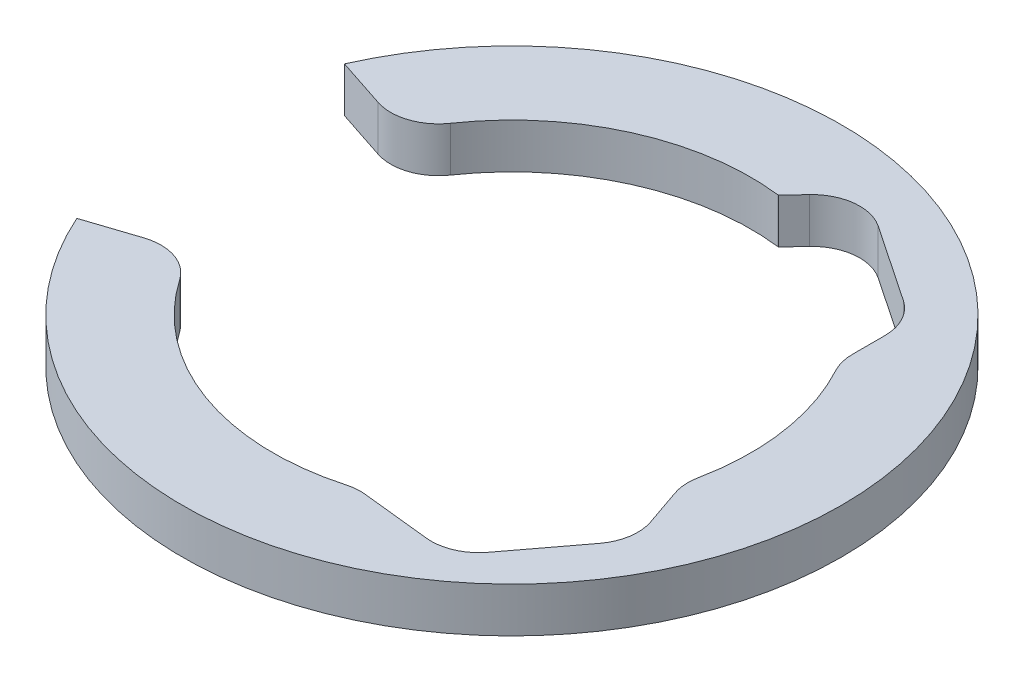
from build123d import *

# Parameters (mm, degrees)
BOSS_EXTRUDE1_DEPTH = 0.94


with BuildPart() as part:
    # Sketch1 → Boss-Extrude1 (new body)
    with BuildSketch(Plane(origin=(0, 0, 0), x_dir=(1, 0, 0), z_dir=(0, 1, 0))):
        with BuildLine():
            Line((-5.253863679, -2.454338371), (-6.305884625, -2.801038932))
            ThreePointArc((-6.305884625, -2.801038932), (6.9, 0), (-6.305884625, 2.801038932))
            Line((-6.305884625, 2.801038932), (-5.253863679, 2.454338371))
            ThreePointArc((-5.253863679, 2.454338371), (-4.621952363, 2.45630843), (-4.117388267, 2.83674353))
            ThreePointArc((-4.117388267, 2.83674353), (-2.052207562, 4.559434627), (0.606687952, 4.963056491))
            Line((0.606687952, 4.963056491), (0.616921004, 4.961794884))
            Line((0.616921004, 4.961794884), (0.933263365, 5.299935719))
            ThreePointArc((0.933263365, 5.299935719), (1.550759285, 5.61038152), (2.222116774, 5.446195866))
            Line((2.222116774, 5.446195866), (3.835339689, 4.359739617))
            ThreePointArc((3.835339689, 4.359739617), (4.159519117, 4.000089674), (4.276739309, 3.53030269))
            Line((4.276739309, 3.53030269), (4.276739309, 2.855875044))
            ThreePointArc((4.276739309, 2.855875044), (4.307343479, 2.610372041), (4.397282758, 2.37989587))
            ThreePointArc((4.397282758, 2.37989587), (4.945409591, 0.736833755), (4.900068255, -0.994651244))
            ThreePointArc((4.900068255, -0.994651244), (4.882230643, -1.259101387), (4.934494135, -1.518948622))
            Line((4.934494135, -1.518948622), (5.202364417, -2.297438027))
            ThreePointArc((5.202364417, -2.297438027), (5.244325234, -2.78011945), (5.054466855, -3.22587259))
            Line((5.054466855, -3.22587259), (4.054517147, -4.548527481))
            ThreePointArc((4.054517147, -4.548527481), (3.653996144, -4.863205448), (3.150433841, -4.939784193))
            Line((3.150433841, -4.939784193), (1.714554284, -4.786144484))
            ThreePointArc((1.714554284, -4.786144484), (1.525879552, -4.783859514), (1.340134323, -4.817057193))
            ThreePointArc((1.340134323, -4.817057193), (-1.705489788, -4.700138783), (-4.117388267, -2.83674353))
            ThreePointArc((-4.117388267, -2.83674353), (-4.621952363, -2.45630843), (-5.253863679, -2.454338371))
        make_face()
    extrude(amount=BOSS_EXTRUDE1_DEPTH)


solid = part.part
